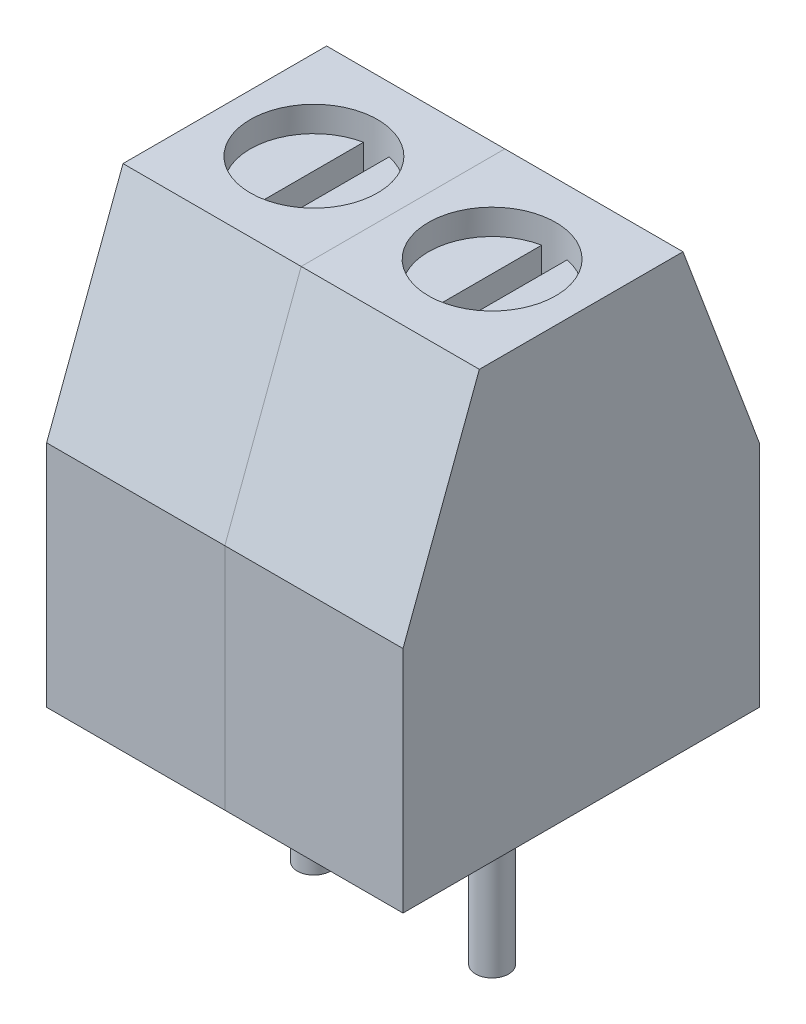
from build123d import *

# Parameters (mm, degrees)
EXTRUDE_1_DEPTH     = 3.5
SKETCH_3_W          = 3
SKETCH_3_H          = 4
CUT_EXTRUDE_1_DEPTH = 1.5
SKETCH_4_R          = 1.25
CUT_EXTRUDE_2_DEPTH = 0.5
CUT_EXTRUDE_3_DEPTH = 0.5
SKETCH_7_R          = 1
CUT_EXTRUDE_4_DEPTH = 3
SKETCH1_R           = 0.325
BOSS_EXTRUDE1_DEPTH = 3.5
LPATTERN1_COUNT     = 2
LPATTERN1_PITCH     = 3.5


with BuildPart() as part:
    # 스케치1 → 보스-돌출1 (new body)
    with BuildSketch(Plane(origin=(0, 0, 0), x_dir=(0, 0, -1), z_dir=(1, 0, 0))):
        Polygon((0, 0), (7, 0), (7, 4.5), (5.5, 8.5), (1.5, 8.5), (0, 4.5), align=None)
    extrude(amount=EXTRUDE_1_DEPTH)

    # 스케치3 → 컷-돌출1 (cut)
    with BuildSketch(Plane(origin=(0, 0, -7), x_dir=(-1, 0, 0), z_dir=(0, 0, -1))):
        with Locations((-1.75, 2.5)):
            Rectangle(SKETCH_3_W, SKETCH_3_H)
    extrude(amount=-CUT_EXTRUDE_1_DEPTH, mode=Mode.SUBTRACT)

    # 스케치4 → 컷-돌출2 (cut)
    with BuildSketch(Plane(origin=(0, 8.5, 0), x_dir=(1, 0, 0), z_dir=(0, 1, 0))):
        with Locations(Location((1.75, 3.5, 0), (0, 0, 270))):
            Circle(SKETCH_4_R)
    extrude(amount=-CUT_EXTRUDE_2_DEPTH, mode=Mode.SUBTRACT)

    # 스케치5 → 컷-돌출3 (cut)
    with BuildSketch(Plane(origin=(0, 8, 0), x_dir=(1, 0, 0), z_dir=(0, 1, 0))):
        with BuildLine():
            Line((1.500050042, 4.724755085), (1.500050042, 2.275244915))
            ThreePointArc((1.500050042, 2.275244915), (1.75, 2.25), (1.999949958, 2.275244915))
            Line((1.999949958, 2.275244915), (1.999949958, 4.724755085))
            ThreePointArc((1.999949958, 4.724755085), (1.75, 4.75), (1.500050042, 4.724755085))
        make_face()
    extrude(amount=-CUT_EXTRUDE_3_DEPTH, mode=Mode.SUBTRACT)

    # 스케치7 → 컷-돌출4 (cut)
    with BuildSketch(Plane(origin=(0, 0, -5.5), x_dir=(-1, 0, 0), z_dir=(0, 0, -1))):
        with Locations((-1.75, 2)):
            Circle(SKETCH_7_R)
    extrude(amount=-CUT_EXTRUDE_4_DEPTH, mode=Mode.SUBTRACT)

    # Sketch1 → Boss-Extrude1 (add)
    with BuildSketch(Plane.XZ):
        with Locations(Location((1.75, -3.5, 0), (0, 0, 90))):
            Circle(SKETCH1_R)
    extrude(amount=BOSS_EXTRUDE1_DEPTH)


with BuildPart() as lpattern1_1:
    # LPattern1: pattern copy
    add(part.part.moved(Location(Vector(1, 0, 0) * (1 * LPATTERN1_PITCH))))


solid = Compound([part.part, lpattern1_1.part])
